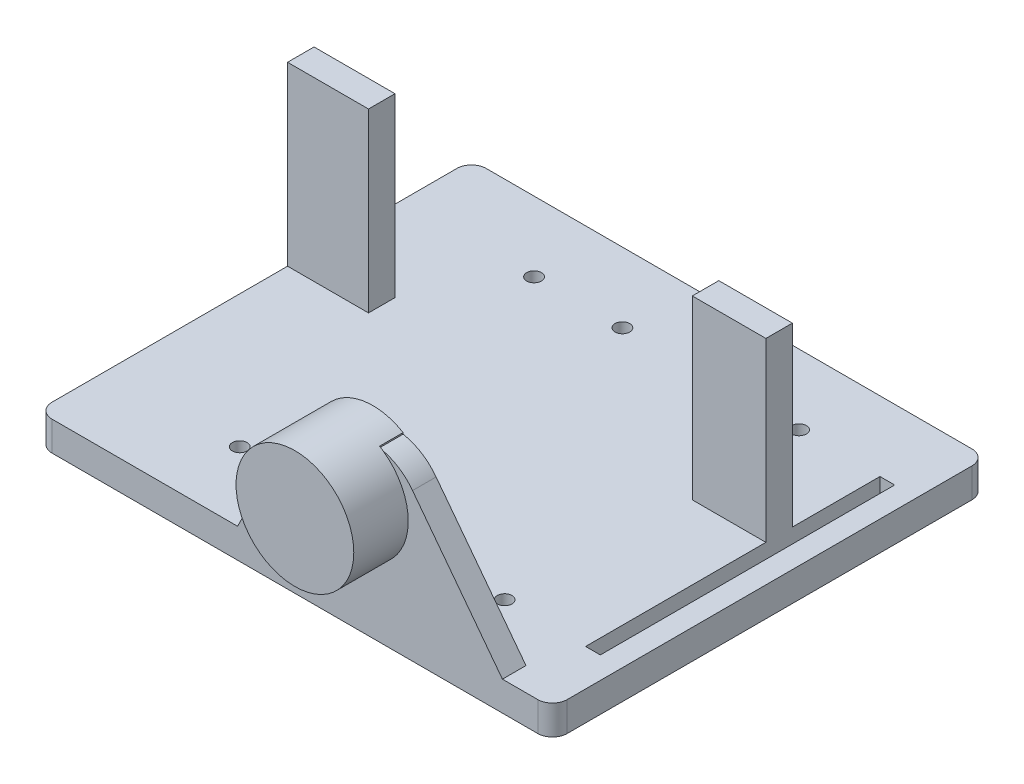
from build123d import *

# Parameters (mm, degrees)
CROQUIS1_W              = 35
CROQUIS1_H              = 29.5
SALIENTE_EXTRUIR1_DEPTH = 2
SALIENTE_EXTRUIR2_DEPTH = 1.6
CROQUIS3_R              = 4
SALIENTE_EXTRUIR3_DEPTH = 3.7
CROQUIS4_W              = 5.5
CROQUIS4_H              = 1.8
CROQUIS4_W_2            = 5
SALIENTE_EXTRUIR4_DEPTH = 12
CROQUIS5_W              = 1
CROQUIS5_H              = 20
CORTAR_EXTRUIR1_DEPTH   = 29.118543703
CROQUIS6_R              = 0.500490027
CORTAR_EXTRUIR2_DEPTH   = 12
REDONDEO1_R             = 1
SALIENTE_EXTRUIR5_START = 1.6
SALIENTE_EXTRUIR5_DEPTH = 1.6


with BuildPart() as part:
    # Croquis1 → Saliente-Extruir1 (new body)
    with BuildSketch(Plane(origin=(0, 0, 0), x_dir=(1, 0, 0), z_dir=(0, 1, 0))):
        Rectangle(CROQUIS1_W, CROQUIS1_H)
    extrude(amount=SALIENTE_EXTRUIR1_DEPTH)

    # Croquis2 → Saliente-Extruir2 (add)
    with BuildSketch(Plane.XY.offset(14.75)):
        with BuildLine():
            Line((14.1, 2), (-3.9, 2))
            Line((-3.9, 2), (2.207935866, 10.043820198))
            ThreePointArc((2.207935866, 10.043820198), (5.1, 11.5), (7.992064134, 10.043820198))
            Line((7.992064134, 10.043820198), (14.1, 2))
        make_face()
    extrude(amount=-SALIENTE_EXTRUIR2_DEPTH)

    # Croquis3 → Saliente-Extruir3 (add)
    with BuildSketch(Plane.XY.offset(14.75)):
        with Locations(Location((3.7, 8.1, 0), (0, 0, 196.564510331))):
            Circle(CROQUIS3_R)
    extrude(amount=SALIENTE_EXTRUIR3_DEPTH)

    # Croquis4 → Saliente-Extruir4 (add)
    with BuildSketch(Plane(origin=(0, 2, 0), x_dir=(1, 0, 0), z_dir=(0, 1, 0))):
        with Locations((-14.75, 3.15)):
            Rectangle(CROQUIS4_W, CROQUIS4_H)
        with Locations((12.5, 3.15)):
            Rectangle(CROQUIS4_W_2, CROQUIS4_H)
    extrude(amount=SALIENTE_EXTRUIR4_DEPTH)

    # Croquis5 → Cortar-Extruir1 (cut, through all)
    with BuildSketch(Plane(origin=(0, 2, 0), x_dir=(1, 0, 0), z_dir=(0, 1, 0))):
        with Locations((15.5, 0)):
            Rectangle(CROQUIS5_W, CROQUIS5_H)
    extrude(amount=-CORTAR_EXTRUIR1_DEPTH, mode=Mode.SUBTRACT)

    # Croquis6 → Cortar-Extruir2 (cut)
    with BuildSketch(Plane.XZ):
        with Locations(Location((-8.5, -10, 0), (0, 0, 270))):
            Circle(CROQUIS6_R)
        with Locations(Location((-2.5, -10, 0), (0, 0, 270))):
            Circle(CROQUIS6_R)
        with Locations(Location((3.5, -10, 0), (0, 0, 270))):
            Circle(CROQUIS6_R)
        with Locations(Location((9.5, -10, 0), (0, 0, 270))):
            Circle(CROQUIS6_R)
        with Locations(Location((-2.5, 10, 0), (0, 0, 270))):
            Circle(CROQUIS6_R)
        with Locations(Location((3.5, 10, 0), (0, 0, 270))):
            Circle(CROQUIS6_R)
        with Locations(Location((9.5, 10, 0), (0, 0, 270))):
            Circle(CROQUIS6_R)
        with Locations(Location((-8.5, 10, 0), (0, 0, 270))):
            Circle(CROQUIS6_R)
    extrude(amount=-CORTAR_EXTRUIR2_DEPTH, mode=Mode.SUBTRACT)

    # Redondeo1
    redondeo1_edges = [part.edges().sort_by_distance(p)[0] for p in [
        (17.5, 1, 14.75),
        (-17.5, 1, 14.75),
        (-17.5, 1, -14.75),
        (17.5, 1, -14.75),
    ]]
    fillet(redondeo1_edges, radius=REDONDEO1_R)

    # Croquis7 → Saliente-Extruir5 (add)
    with BuildSketch(Plane(origin=(0, 0, 14.75), x_dir=(-1, 0, 0), z_dir=(0, 0, -1)).offset(SALIENTE_EXTRUIR5_START)):
        with BuildLine():
            Line((3.9, 2), (-0.052229294, 9.741270508))
            ThreePointArc((-0.052229294, 9.741270508), (-2.499470939, 11.915590383), (-5.750816337, 11.534261544))
            Line((-5.750816337, 11.534261544), (-5.750816337, 2))
            Line((-5.750816337, 2), (3.9, 2))
        make_face()
    extrude(amount=-SALIENTE_EXTRUIR5_DEPTH)


solid = part.part
